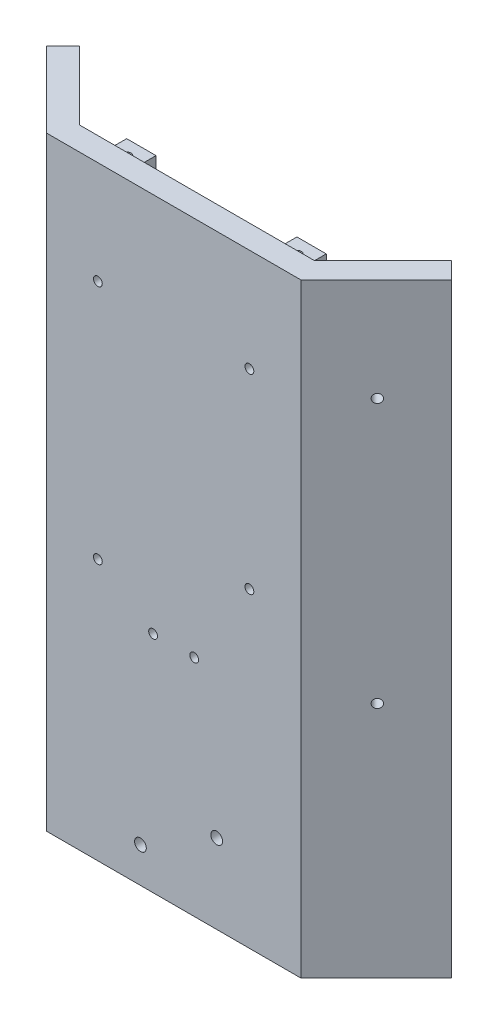
from build123d import *

# Parameters (mm, degrees)
BOSS_EXTRUDE1_DEPTH            = 206
SKETCH2_W                      = 10
SKETCH2_H                      = 6
BOSS_EXTRUDE2_DEPTH            = 10
CUT_EXTRUDE1_REACH             = 214.848
SKETCH3_R                      = 1.5
CUT_EXTRUDE2_REACH             = 221.494
SKETCH4_R                      = 2
CUT_EXTRUDE3_REACH             = 221.494
SKETCH5_R                      = 1.5
CUT_EXTRUDE4_REACH             = 221.494
SKETCH6_R                      = 1.5
CUT_EXTRUDE5_REACH             = 233.936
SKETCH7_R                      = 1.5
CUT_EXTRUDE5_DIRECTION_2_DEPTH = 232.93629081
CUT_EXTRUDE6_REACH             = 233.936
SKETCH9_R                      = 1.5


with BuildPart() as part:
    # Sketch1 → Boss-Extrude1 (new body)
    with BuildSketch(Plane(origin=(0, 0, 0), x_dir=(1, 0, 0), z_dir=(0, 1, 0))):
        Polygon((-40, 0), (40, 0), (63.334523779, 23.334523779), (68.991378029, 17.67766953), (43.313708499, -8), (-43.313708499, -8), (-68.991378029, 17.67766953), (-63.334523779, 23.334523779), align=None)
    extrude(amount=BOSS_EXTRUDE1_DEPTH)

    # Sketch2 → Boss-Extrude2 (add)
    with BuildSketch(Plane(origin=(0, 0, 0), x_dir=(-1, 0, 0), z_dir=(0, 0, -1))):
        with Locations((-29, 197)):
            Rectangle(SKETCH2_W, SKETCH2_H)
        with Locations((29, 197)):
            Rectangle(SKETCH2_W, SKETCH2_H)
    extrude(amount=BOSS_EXTRUDE2_DEPTH)

    # Sketch3 → Cut-Extrude1 (cut, up to next)
    with BuildSketch(Plane(origin=(0, 200, 0), x_dir=(1, 0, 0), z_dir=(0, 1, 0)), mode=Mode.PRIVATE) as cut_extrude1_sk1:
        with Locations(Location((-29, 5, 0), (0, 0, 180))):
            Circle(SKETCH3_R)
    cut_extrude1_tool1 = extrude(cut_extrude1_sk1.sketch, amount=-CUT_EXTRUDE1_REACH, mode=Mode.PRIVATE) & part.part
    # Sketch3 → Cut-Extrude1 (cut, up to next)
    with BuildSketch(Plane(origin=(0, 200, 0), x_dir=(1, 0, 0), z_dir=(0, 1, 0)), mode=Mode.PRIVATE) as cut_extrude1_sk2:
        with Locations(Location((29, 5, 0), (0, 0, 180))):
            Circle(SKETCH3_R)
    cut_extrude1_tool2 = extrude(cut_extrude1_sk2.sketch, amount=-CUT_EXTRUDE1_REACH, mode=Mode.PRIVATE) & part.part
    add(cut_extrude1_tool1.solids().sort_by_distance((-29, 200, -5))[0], mode=Mode.SUBTRACT)
    add(cut_extrude1_tool2.solids().sort_by_distance((29, 200, -5))[0], mode=Mode.SUBTRACT)

    # Sketch4 → Cut-Extrude2 (cut, up to next)
    with BuildSketch(Plane.XY.offset(8), mode=Mode.PRIVATE) as cut_extrude2_sk1:
        with Locations((-11.313708499, 12)):
            Circle(SKETCH4_R)
    cut_extrude2_tool1 = extrude(cut_extrude2_sk1.sketch, amount=-CUT_EXTRUDE2_REACH, mode=Mode.PRIVATE) & part.part
    # Sketch4 → Cut-Extrude2 (cut, up to next)
    with BuildSketch(Plane.XY.offset(8), mode=Mode.PRIVATE) as cut_extrude2_sk2:
        with Locations((14.667053615, 27)):
            Circle(SKETCH4_R)
    cut_extrude2_tool2 = extrude(cut_extrude2_sk2.sketch, amount=-CUT_EXTRUDE2_REACH, mode=Mode.PRIVATE) & part.part
    add(cut_extrude2_tool1.solids().sort_by_distance((-11.313708, 12, 8))[0], mode=Mode.SUBTRACT)
    add(cut_extrude2_tool2.solids().sort_by_distance((14.667054, 27, 8))[0], mode=Mode.SUBTRACT)

    # Sketch5 → Cut-Extrude3 (cut, up to next)
    with BuildSketch(Plane.XY.offset(8), mode=Mode.PRIVATE) as cut_extrude3_sk1:
        with Locations((7, 76.404082058)):
            Circle(SKETCH5_R)
    cut_extrude3_tool1 = extrude(cut_extrude3_sk1.sketch, amount=-CUT_EXTRUDE3_REACH, mode=Mode.PRIVATE) & part.part
    # Sketch5 → Cut-Extrude3 (cut, up to next)
    with BuildSketch(Plane.XY.offset(8), mode=Mode.PRIVATE) as cut_extrude3_sk2:
        with Locations((-7, 76.404082058)):
            Circle(SKETCH5_R)
    cut_extrude3_tool2 = extrude(cut_extrude3_sk2.sketch, amount=-CUT_EXTRUDE3_REACH, mode=Mode.PRIVATE) & part.part
    add(cut_extrude3_tool1.solids().sort_by_distance((7, 76.404082, 8))[0], mode=Mode.SUBTRACT)
    add(cut_extrude3_tool2.solids().sort_by_distance((-7, 76.404082, 8))[0], mode=Mode.SUBTRACT)

    # Sketch6 → Cut-Extrude4 (cut, up to next)
    with BuildSketch(Plane.XY.offset(8), mode=Mode.PRIVATE) as cut_extrude4_sk1:
        with Locations((25.813708499, 171)):
            Circle(SKETCH6_R)
    cut_extrude4_tool1 = extrude(cut_extrude4_sk1.sketch, amount=-CUT_EXTRUDE4_REACH, mode=Mode.PRIVATE) & part.part
    # Sketch6 → Cut-Extrude4 (cut, up to next)
    with BuildSketch(Plane.XY.offset(8), mode=Mode.PRIVATE) as cut_extrude4_sk2:
        with Locations((-25.813708499, 171)):
            Circle(SKETCH6_R)
    cut_extrude4_tool2 = extrude(cut_extrude4_sk2.sketch, amount=-CUT_EXTRUDE4_REACH, mode=Mode.PRIVATE) & part.part
    # Sketch6 → Cut-Extrude4 (cut, up to next)
    with BuildSketch(Plane.XY.offset(8), mode=Mode.PRIVATE) as cut_extrude4_sk3:
        with Locations((25.813708499, 106)):
            Circle(SKETCH6_R)
    cut_extrude4_tool3 = extrude(cut_extrude4_sk3.sketch, amount=-CUT_EXTRUDE4_REACH, mode=Mode.PRIVATE) & part.part
    # Sketch6 → Cut-Extrude4 (cut, up to next)
    with BuildSketch(Plane.XY.offset(8), mode=Mode.PRIVATE) as cut_extrude4_sk4:
        with Locations((-25.813708499, 89)):
            Circle(SKETCH6_R)
    cut_extrude4_tool4 = extrude(cut_extrude4_sk4.sketch, amount=-CUT_EXTRUDE4_REACH, mode=Mode.PRIVATE) & part.part
    add(cut_extrude4_tool1.solids().sort_by_distance((25.813708, 171, 8))[0], mode=Mode.SUBTRACT)
    add(cut_extrude4_tool2.solids().sort_by_distance((-25.813708, 171, 8))[0], mode=Mode.SUBTRACT)
    add(cut_extrude4_tool3.solids().sort_by_distance((25.813708, 106, 8))[0], mode=Mode.SUBTRACT)
    add(cut_extrude4_tool4.solids().sort_by_distance((-25.813708, 89, 8))[0], mode=Mode.SUBTRACT)

    # Sketch7 → Cut-Extrude5 (cut, up to next)
    with BuildSketch(Plane(origin=(25.656854249, 0, 25.656854249), x_dir=(0.7071067811865462, 0, -0.7071067811865489), z_dir=(0.7071067811865489, 0, 0.7071067811865462)), mode=Mode.PRIVATE) as cut_extrude5_sk1:
        with Locations(Location((43.410562748, 171, 0), (0, 0, 180))):
            Circle(SKETCH7_R)
    cut_extrude5_tool1 = extrude(cut_extrude5_sk1.sketch, amount=-CUT_EXTRUDE5_REACH, mode=Mode.PRIVATE) & part.part
    # Sketch7 → Cut-Extrude5 (cut, up to next)
    with BuildSketch(Plane(origin=(25.656854249, 0, 25.656854249), x_dir=(0.7071067811865462, 0, -0.7071067811865489), z_dir=(0.7071067811865489, 0, 0.7071067811865462)), mode=Mode.PRIVATE) as cut_extrude5_sk2:
        with Locations(Location((43.410562748, 81, 0), (0, 0, 180))):
            Circle(SKETCH7_R)
    cut_extrude5_tool2 = extrude(cut_extrude5_sk2.sketch, amount=-CUT_EXTRUDE5_REACH, mode=Mode.PRIVATE) & part.part
    add(cut_extrude5_tool1.solids().sort_by_distance((56.352758, 171, -5.039049))[0], mode=Mode.SUBTRACT)
    add(cut_extrude5_tool2.solids().sort_by_distance((56.352758, 81, -5.039049))[0], mode=Mode.SUBTRACT)

    # Sketch7 → Cut-Extrude5 direction 2 (cut)
    with BuildSketch(Plane(origin=(25.656854249, 0, 25.656854249), x_dir=(0.7071067811865462, 0, -0.7071067811865489), z_dir=(0.7071067811865489, 0, 0.7071067811865462))):
        with Locations(Location((43.410562748, 171, 0), (0, 0, 180))):
            Circle(SKETCH7_R)
        with Locations(Location((43.410562748, 81, 0), (0, 0, 180))):
            Circle(SKETCH7_R)
    extrude(amount=CUT_EXTRUDE5_DIRECTION_2_DEPTH, mode=Mode.SUBTRACT)

    # Sketch9 → Cut-Extrude6 (cut, up to next)
    with BuildSketch(Plane(origin=(-25.656854249, 0, 25.656854249), x_dir=(0.707106781186551, 0, 0.7071067811865441), z_dir=(-0.7071067811865441, 0, 0.707106781186551)), mode=Mode.PRIVATE) as cut_extrude6_sk1:
        with Locations((-40.384271247, 171)):
            Circle(SKETCH9_R)
    cut_extrude6_tool1 = extrude(cut_extrude6_sk1.sketch, amount=-CUT_EXTRUDE6_REACH, mode=Mode.PRIVATE) & part.part
    # Sketch9 → Cut-Extrude6 (cut, up to next)
    with BuildSketch(Plane(origin=(-25.656854249, 0, 25.656854249), x_dir=(0.707106781186551, 0, 0.7071067811865441), z_dir=(-0.7071067811865441, 0, 0.707106781186551)), mode=Mode.PRIVATE) as cut_extrude6_sk2:
        with Locations((-40.384271247, 76)):
            Circle(SKETCH9_R)
    cut_extrude6_tool2 = extrude(cut_extrude6_sk2.sketch, amount=-CUT_EXTRUDE6_REACH, mode=Mode.PRIVATE) & part.part
    add(cut_extrude6_tool1.solids().sort_by_distance((-54.212846, 171, -2.899138))[0], mode=Mode.SUBTRACT)
    add(cut_extrude6_tool2.solids().sort_by_distance((-54.212846, 76, -2.899138))[0], mode=Mode.SUBTRACT)


solid = part.part
